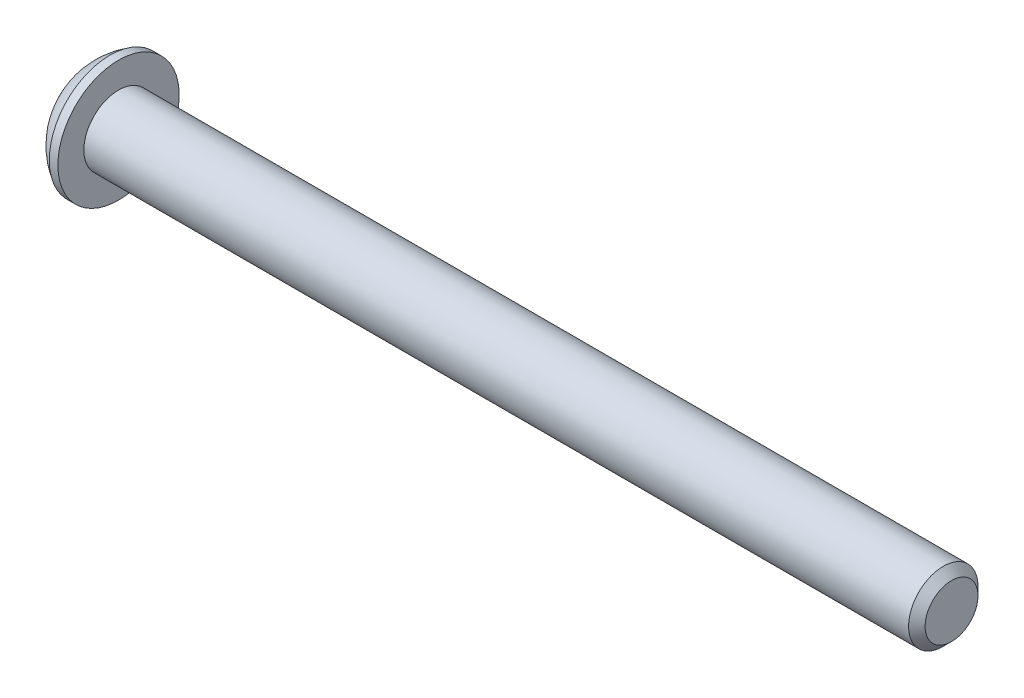
from build123d import *

# Parameters (mm, degrees)
HEX_2_DEPTH = 2.2098


with BuildPart() as part:
    # BodySke → BaseBody (revolve)
    with BuildSketch(Plane.XY, mode=Mode.PRIVATE) as basebody_sk:
        with BuildLine():
            Line((79.5528, 0), (79.5528, 2.41935))
            Line((79.5528, 2.41935), (78.79715, 3.175))
            Line((78.79715, 3.175), (3.3528, 3.175))
            Line((3.3528, 3.175), (3.3528, 5.5499))
            Line((3.3528, 5.5499), (2.5654, 5.5499))
            ThreePointArc((2.5654, 5.5499), (1.073764503, 4.355582759), (0, 2.77495))
            Line((0, 2.77495), (0, 0))
            Line((0, 0), (79.5528, 0))
        make_face()
    revolve(basebody_sk.sketch.rotate(Axis((0, 0, 0), (1, 0, 0)), 90), axis=Axis((0, 0, 0), (1, 0, 0)))

    # Sketch2 → PreBroach (revolve, cut)
    with BuildSketch(Plane.XY, mode=Mode.PRIVATE) as prebroach_sk:
        Polygon((0, 1.9812), (2.2098, 1.9812), (3.353646353, 0), (0, 0), align=None)
    revolve(prebroach_sk.sketch.rotate(Axis((0, 0, 0), (1, 0, 0)), 90), axis=Axis((0, 0, 0), (1, 0, 0)), mode=Mode.SUBTRACT)

    # Sketch3 → Hex 2 (cut)
    with BuildSketch(Plane(origin=(0, 0, 0), x_dir=(0, 0, -1), z_dir=(1, 0, 0))):
        Polygon((-1.9812, -1.143846353), (-1.9812, 1.143846353), (0, 2.287692707), (1.9812, 1.143846353), (1.9812, -1.143846353), (0, -2.287692707), align=None)
    extrude(amount=HEX_2_DEPTH, mode=Mode.SUBTRACT)


solid = part.part
